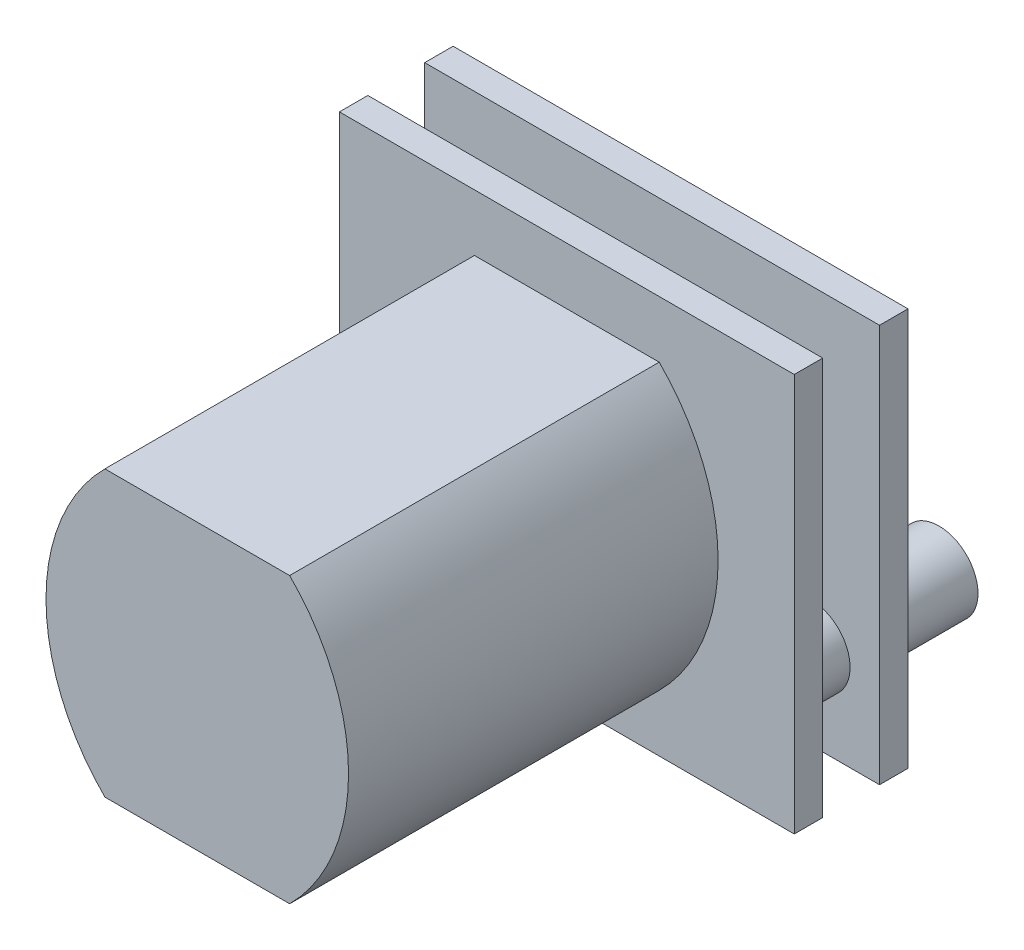
from build123d import *

# Parameters (mm, degrees)
EXTRUDE1_DEPTH  = 13
SKETCH2_W       = 16
SKETCH2_H       = 14
EXTRUDE2_DEPTH  = 1
SKETCH3_R       = 2.248676076
EXTRUDE3_DEPTH  = 1.2
SKETCH4_W       = 0.4
SKETCH4_H       = 0.5
EXTRUDE4_DEPTH  = 1.2
SKETCH5_R       = 1.372998475
EXTRUDE5_DEPTH  = 2
SKETCH6_W       = 16
SKETCH6_H       = 14
EXTRUDE6_DEPTH  = 1
SKETCH7_R       = 1.372998475
EXTRUDE7_DEPTH  = 3.5
SKETCH8_R       = 1.733936405
EXTRUDE8_DEPTH  = 1.2
SKETCH9_W       = 0.301521113
SKETCH9_H       = 0.224907716
EXTRUDE9_DEPTH  = 1.2
SKETCH10_W      = 0.800661527
SKETCH10_H      = 6.121277762
EXTRUDE10_DEPTH = 1.2
SKETCH11_R      = 0.601090718
EXTRUDE11_DEPTH = 1.2
SKETCH12_W      = 0.183794405
SKETCH12_H      = 0.118202218
EXTRUDE12_DEPTH = 1.2
SKETCH13_R      = 2.161420289
EXTRUDE13_DEPTH = 1.2
SKETCH14_W      = 0.467705932
SKETCH14_H      = 0.202573078
EXTRUDE14_DEPTH = 1.2
SKETCH15_R      = 0.577311245
EXTRUDE15_DEPTH = 1.4
SKETCH16_R      = 2.177574352
EXTRUDE16_DEPTH = 0.8
SKETCH17_W      = 0.286885117
SKETCH17_H      = 0.397850676
SKETCH17_W_2    = 0.397850676
SKETCH17_H_2    = 0.286885116
SKETCH17_W_3    = 0.397850677
SKETCH17_W_4    = 0.359139645
SKETCH17_H_3    = 0.201650404
EXTRUDE18_DEPTH = 0.8


with BuildPart() as part:
    # Sketch1 → Extrude1 (new body)
    with BuildSketch(Plane.XY):
        with BuildLine():
            Line((-3.25, 5), (3.25, 5))
            ThreePointArc((3.25, 5), (5.321067812, 0), (3.25, -5))
            Line((3.25, -5), (-3.25, -5))
            ThreePointArc((-3.25, -5), (-5.321067812, 0), (-3.25, 5))
        make_face()
    extrude(amount=EXTRUDE1_DEPTH)

    # Sketch2 → Extrude2 (add)
    with BuildSketch(Plane(origin=(0, 0, 0), x_dir=(-1, 0, 0), z_dir=(0, 0, -1))):
        Rectangle(SKETCH2_W, SKETCH2_H)
    extrude(amount=EXTRUDE2_DEPTH)

    # Sketch3 → Extrude3 (add)
    with BuildSketch(Plane(origin=(0, 0, -1), x_dir=(-1, 0, 0), z_dir=(0, 0, -1))):
        Circle(SKETCH3_R)
    extrude(amount=EXTRUDE3_DEPTH)

    # Sketch4 → Extrude4 (cut)
    with BuildSketch(Plane(origin=(0, 0, -2.2), x_dir=(-1, 0, 0), z_dir=(0, 0, -1))):
        Polygon((-0.459805613, -1.955322187), (-0.622155347, -2.428230808), (-1.000482244, -2.29835102), (-0.838132509, -1.825442399), align=None)
        with Locations((0, -2.248676076)):
            Rectangle(SKETCH4_W, SKETCH4_H)
        Polygon((-1.069784152, -1.700078799), (-1.376890509, -2.094649054), (-1.692546713, -1.848963969), (-1.385440356, -1.454393714), align=None)
        Polygon((-1.56383498, -1.260605494), (-1.982418219, -1.534079573), (-2.201197482, -1.199212982), (-1.782614243, -0.925738903), align=None)
        Polygon((-1.888420022, -0.684526023), (-2.373120155, -0.807268767), (-2.47131435, -0.41950866), (-1.986614217, -0.296765917), align=None)
        Polygon((-2.008365453, -0.034267536), (-2.506657699, 0.007022136), (-2.473625961, 0.405655933), (-1.975333715, 0.364366261), align=None)
        Polygon((-1.910673324, 0.61970437), (-2.368559987, 0.820552082), (-2.207881817, 1.186861413), (-1.749995154, 0.9860137), align=None)
        Polygon((-1.605930093, 1.206521692), (-1.973792048, 1.545162477), (-1.70287942, 1.839452042), (-1.335017464, 1.500811256), align=None)
        Polygon((-1.127159418, 1.662593667), (-1.365133115, 2.102330543), (-1.013343614, 2.2927095), (-0.775369918, 1.852972624), align=None)
        Polygon((-0.52624353, 1.938497821), (-0.608540826, 2.431678473), (-0.213996304, 2.497516309), (-0.131699009, 2.004335657), align=None)
        Polygon((0.131699009, 2.004335657), (0.213996304, 2.497516309), (0.608540826, 2.431678473), (0.52624353, 1.938497821), align=None)
        Polygon((0.775369918, 1.852972624), (1.013343614, 2.2927095), (1.365133115, 2.102330543), (1.127159418, 1.662593667), align=None)
        Polygon((1.335017464, 1.500811256), (1.70287942, 1.839452042), (1.973792048, 1.545162477), (1.605930093, 1.206521692), align=None)
        Polygon((1.749995154, 0.9860137), (2.207881817, 1.186861413), (2.368559987, 0.820552082), (1.910673324, 0.61970437), align=None)
        Polygon((1.975333715, 0.364366261), (2.473625961, 0.405655933), (2.506657699, 0.007022136), (2.008365453, -0.034267536), align=None)
        Polygon((1.986614217, -0.296765917), (2.47131435, -0.41950866), (2.373120155, -0.807268767), (1.888420022, -0.684526023), align=None)
        Polygon((1.782614243, -0.925738903), (2.201197482, -1.199212982), (1.982418219, -1.534079573), (1.56383498, -1.260605494), align=None)
        Polygon((1.385440356, -1.454393714), (1.692546713, -1.848963969), (1.376890509, -2.094649054), (1.069784152, -1.700078799), align=None)
        Polygon((0.838132509, -1.825442399), (1.000482244, -2.29835102), (0.622155347, -2.428230808), (0.459805613, -1.955322187), align=None)
    extrude(amount=-EXTRUDE4_DEPTH, mode=Mode.SUBTRACT)

    # Sketch5 → Extrude5 (add)
    with BuildSketch(Plane(origin=(0, 0, -1), x_dir=(-1, 0, 0), z_dir=(0, 0, -1))):
        with Locations((-5.590617774, -3.94150511)):
            Circle(SKETCH5_R)
    extrude(amount=EXTRUDE5_DEPTH)

    # Sketch6 → Extrude6 (add)
    with BuildSketch(Plane(origin=(0, 0, -3), x_dir=(-1, 0, 0), z_dir=(0, 0, -1))):
        Rectangle(SKETCH6_W, SKETCH6_H)
    extrude(amount=EXTRUDE6_DEPTH)

    # Sketch7 → Extrude7 (add)
    with BuildSketch(Plane(origin=(0, 0, -4), x_dir=(-1, 0, 0), z_dir=(0, 0, -1))):
        with Locations((-5.590617774, -3.94150511)):
            Circle(SKETCH7_R)
    extrude(amount=EXTRUDE7_DEPTH)

    # Sketch8 → Extrude8 (add)
    with BuildSketch(Plane(origin=(0, 0, -4), x_dir=(-1, 0, 0), z_dir=(0, 0, -1))):
        with Locations(Location((0, 0, 0), (0, 0, 180))):
            Circle(SKETCH8_R)
    extrude(amount=EXTRUDE8_DEPTH)

    # Sketch9 → Extrude9 (cut)
    with BuildSketch(Plane(origin=(0, 0, -5.2), x_dir=(-1, 0, 0), z_dir=(0, 0, -1))):
        with Locations((1.733936406, 0)):
            Rectangle(SKETCH9_W, SKETCH9_H)
        Polygon((1.840035405, -0.423081807), (1.776671579, -0.638879181), (1.48736419, -0.553930867), (1.550728016, -0.338133493), align=None)
        Polygon((1.646305123, -0.9243419), (1.524710831, -1.113546312), (1.27105513, -0.950531691), (1.392649422, -0.761327279), align=None)
        Polygon((1.319200991, -1.35071731), (1.14922708, -1.498000543), (0.951772743, -1.27012609), (1.121746654, -1.122842858), align=None)
        Polygon((0.885223041, -1.667665637), (0.680639785, -1.761095679), (0.555383388, -1.486822428), (0.759966644, -1.393392385), align=None)
        Polygon((0.379529584, -1.849509612), (0.156911103, -1.881517317), (0.114000175, -1.583065254), (0.336618655, -1.551057549), align=None)
        Polygon((-0.156911103, -1.881517317), (-0.379529584, -1.849509612), (-0.336618655, -1.551057549), (-0.114000175, -1.583065254), align=None)
        Polygon((-0.680639785, -1.761095679), (-0.885223041, -1.667665637), (-0.759966644, -1.393392385), (-0.555383388, -1.486822428), align=None)
        Polygon((-1.14922708, -1.498000543), (-1.319200991, -1.35071731), (-1.121746654, -1.122842858), (-0.951772743, -1.27012609), align=None)
        Polygon((-1.524710831, -1.113546312), (-1.646305123, -0.9243419), (-1.392649422, -0.761327279), (-1.27105513, -0.950531691), align=None)
        Polygon((-1.776671579, -0.638879181), (-1.840035405, -0.423081807), (-1.550728016, -0.338133493), (-1.48736419, -0.553930867), align=None)
        with Locations((-1.733936406, 0)):
            Rectangle(SKETCH9_W, SKETCH9_H)
        Polygon((-1.840035405, 0.423081807), (-1.776671579, 0.638879181), (-1.48736419, 0.553930867), (-1.550728016, 0.338133493), align=None)
        Polygon((-1.646305123, 0.9243419), (-1.524710831, 1.113546312), (-1.27105513, 0.950531691), (-1.392649422, 0.761327279), align=None)
        Polygon((-1.319200991, 1.35071731), (-1.14922708, 1.498000543), (-0.951772743, 1.27012609), (-1.121746654, 1.122842858), align=None)
        Polygon((-0.885223041, 1.667665637), (-0.680639785, 1.761095679), (-0.555383388, 1.486822428), (-0.759966644, 1.393392385), align=None)
        Polygon((-0.379529584, 1.849509612), (-0.156911103, 1.881517317), (-0.114000175, 1.583065254), (-0.336618655, 1.551057549), align=None)
        Polygon((0.156911103, 1.881517317), (0.379529584, 1.849509612), (0.336618655, 1.551057549), (0.114000175, 1.583065254), align=None)
        Polygon((0.680639785, 1.761095679), (0.885223041, 1.667665637), (0.759966644, 1.393392385), (0.555383388, 1.486822428), align=None)
        Polygon((1.14922708, 1.498000543), (1.319200991, 1.35071731), (1.121746654, 1.122842858), (0.951772743, 1.27012609), align=None)
        Polygon((1.524710831, 1.113546312), (1.646305123, 0.9243419), (1.392649422, 0.761327279), (1.27105513, 0.950531691), align=None)
        Polygon((1.776671579, 0.638879181), (1.840035405, 0.423081807), (1.550728016, 0.338133493), (1.48736419, 0.553930867), align=None)
    extrude(amount=-EXTRUDE9_DEPTH, mode=Mode.SUBTRACT)

    # Sketch10 → Extrude10 (cut)
    with BuildSketch(Plane.XZ.offset(5)):
        with Locations((1.473917579, 5.887601999)):
            Rectangle(SKETCH10_W, SKETCH10_H)
        with Locations((-1.526082421, 5.887601999)):
            Rectangle(SKETCH10_W, SKETCH10_H)
    extrude(amount=-EXTRUDE10_DEPTH, mode=Mode.SUBTRACT)

    # Sketch11 → Extrude11 (add)
    with BuildSketch(Plane(origin=(0, 0, -5.2), x_dir=(-1, 0, 0), z_dir=(0, 0, -1))):
        Circle(SKETCH11_R)
    extrude(amount=EXTRUDE11_DEPTH)

    # Sketch12 → Extrude12 (cut)
    with BuildSketch(Plane(origin=(0, 0, -6.4), x_dir=(-1, 0, 0), z_dir=(0, 0, -1))):
        with Locations((-0.601090719, 0)):
            Rectangle(SKETCH12_W, SKETCH12_H)
        Polygon((-0.498699159, 0.118617563), (-0.458271619, 0.229691315), (-0.630981866, 0.292552704), (-0.671409406, 0.181478952), align=None)
        Polygon((-0.428054323, 0.282029207), (-0.352075403, 0.372577359), (-0.492870086, 0.490718125), (-0.568849007, 0.400169974), align=None)
        Polygon((-0.305779819, 0.411423965), (-0.203413696, 0.470525074), (-0.295310899, 0.629695699), (-0.397677022, 0.57059459), align=None)
        Polygon((-0.146623756, 0.491194922), (-0.030217296, 0.511720522), (-0.06213286, 0.692722678), (-0.17853932, 0.672197078), align=None)
        Polygon((0.030217296, 0.511720522), (0.146623756, 0.491194922), (0.17853932, 0.672197078), (0.06213286, 0.692722678), align=None)
        Polygon((0.203413696, 0.470525074), (0.305779819, 0.411423965), (0.397677022, 0.57059459), (0.295310899, 0.629695699), align=None)
        Polygon((0.352075403, 0.372577359), (0.428054323, 0.282029207), (0.568849007, 0.400169974), (0.492870086, 0.490718125), align=None)
        Polygon((0.458271619, 0.229691315), (0.498699159, 0.118617563), (0.671409406, 0.181478952), (0.630981866, 0.292552704), align=None)
        with Locations((0.601090719, 0)):
            Rectangle(SKETCH12_W, SKETCH12_H)
        Polygon((0.498699159, -0.118617563), (0.458271619, -0.229691315), (0.630981866, -0.292552704), (0.671409406, -0.181478952), align=None)
        Polygon((0.428054323, -0.282029207), (0.352075403, -0.372577359), (0.492870086, -0.490718125), (0.568849007, -0.400169974), align=None)
        Polygon((0.305779819, -0.411423965), (0.203413696, -0.470525074), (0.295310899, -0.629695699), (0.397677022, -0.57059459), align=None)
        Polygon((0.146623756, -0.491194922), (0.030217296, -0.511720522), (0.06213286, -0.692722678), (0.17853932, -0.672197078), align=None)
        Polygon((-0.030217296, -0.511720522), (-0.146623756, -0.491194922), (-0.17853932, -0.672197078), (-0.06213286, -0.692722678), align=None)
        Polygon((-0.203413696, -0.470525074), (-0.305779819, -0.411423965), (-0.397677022, -0.57059459), (-0.295310899, -0.629695699), align=None)
        Polygon((-0.352075403, -0.372577359), (-0.428054323, -0.282029207), (-0.568849007, -0.400169974), (-0.492870086, -0.490718125), align=None)
        Polygon((-0.458271619, -0.229691315), (-0.498699159, -0.118617563), (-0.671409406, -0.181478952), (-0.630981866, -0.292552704), align=None)
    extrude(amount=-EXTRUDE12_DEPTH, mode=Mode.SUBTRACT)

    # Sketch13 → Extrude13 (add)
    with BuildSketch(Plane(origin=(0, 0, -6.4), x_dir=(-1, 0, 0), z_dir=(0, 0, -1))):
        Circle(SKETCH13_R)
    extrude(amount=EXTRUDE13_DEPTH)

    # Sketch14 → Extrude14 (cut)
    with BuildSketch(Plane(origin=(0, 0, -7.6), x_dir=(-1, 0, 0), z_dir=(0, 0, -1))):
        with Locations((-2.161420289, 0)):
            Rectangle(SKETCH14_W, SKETCH14_H)
        Polygon((-2.349910423, 0.474883074), (-2.301431513, 0.671569746), (-1.847316265, 0.55964039), (-1.895795176, 0.362953719), align=None)
        Polygon((-2.167979339, 1.023454209), (-2.073838936, 1.202823761), (-1.6597059, 0.985469977), (-1.753846303, 0.806100425), align=None)
        Polygon((-1.860053175, 1.512545906), (-1.725722378, 1.664174031), (-1.375639461, 1.35402763), (-1.509970258, 1.202399505), align=None)
        Polygon((-1.444027482, 1.913733932), (-1.277313108, 2.028808556), (-1.011625856, 1.64389412), (-1.178340231, 1.528819496), align=None)
        Polygon((-0.944080161, 2.203702698), (-0.754671043, 2.275536101), (-0.588820234, 1.838223458), (-0.778229352, 1.766390055), align=None)
        Polygon((-0.389266332, 2.365600273), (-0.188170241, 2.39001776), (-0.13179452, 1.925721931), (-0.332890612, 1.901304444), align=None)
        Polygon((0.188170241, 2.39001776), (0.389266332, 2.365600273), (0.332890612, 1.901304444), (0.13179452, 1.925721931), align=None)
        Polygon((0.754671043, 2.275536101), (0.944080161, 2.203702698), (0.778229352, 1.766390055), (0.588820234, 1.838223458), align=None)
        Polygon((1.277313108, 2.028808556), (1.444027482, 1.913733932), (1.178340231, 1.528819496), (1.011625856, 1.64389412), align=None)
        Polygon((1.725722378, 1.664174031), (1.860053175, 1.512545906), (1.509970258, 1.202399505), (1.375639461, 1.35402763), align=None)
        Polygon((2.073838936, 1.202823761), (2.167979339, 1.023454209), (1.753846303, 0.806100425), (1.6597059, 0.985469977), align=None)
        Polygon((2.301431513, 0.671569746), (2.349910423, 0.474883074), (1.895795176, 0.362953719), (1.847316265, 0.55964039), align=None)
        with Locations((2.161420289, 0)):
            Rectangle(SKETCH14_W, SKETCH14_H)
        Polygon((2.349910423, -0.474883074), (2.301431513, -0.671569746), (1.847316265, -0.55964039), (1.895795176, -0.362953719), align=None)
        Polygon((2.167979339, -1.023454209), (2.073838936, -1.202823761), (1.6597059, -0.985469977), (1.753846303, -0.806100425), align=None)
        Polygon((1.860053175, -1.512545906), (1.725722378, -1.664174031), (1.375639461, -1.35402763), (1.509970258, -1.202399505), align=None)
        Polygon((1.444027482, -1.913733932), (1.277313108, -2.028808556), (1.011625856, -1.64389412), (1.178340231, -1.528819496), align=None)
        Polygon((0.944080161, -2.203702698), (0.754671043, -2.275536101), (0.588820234, -1.838223458), (0.778229352, -1.766390055), align=None)
        Polygon((0.389266332, -2.365600273), (0.188170241, -2.39001776), (0.13179452, -1.925721931), (0.332890612, -1.901304444), align=None)
        Polygon((-0.188170241, -2.39001776), (-0.389266332, -2.365600273), (-0.332890612, -1.901304444), (-0.13179452, -1.925721931), align=None)
        Polygon((-0.754671043, -2.275536101), (-0.944080161, -2.203702698), (-0.778229352, -1.766390055), (-0.588820234, -1.838223458), align=None)
        Polygon((-1.277313108, -2.028808556), (-1.444027482, -1.913733932), (-1.178340231, -1.528819496), (-1.011625856, -1.64389412), align=None)
        Polygon((-1.725722378, -1.664174031), (-1.860053175, -1.512545906), (-1.509970258, -1.202399505), (-1.375639461, -1.35402763), align=None)
        Polygon((-2.073838936, -1.202823761), (-2.167979339, -1.023454209), (-1.753846303, -0.806100425), (-1.6597059, -0.985469977), align=None)
        Polygon((-2.301431513, -0.671569746), (-2.349910423, -0.474883074), (-1.895795176, -0.362953719), (-1.847316265, -0.55964039), align=None)
    extrude(amount=-EXTRUDE14_DEPTH, mode=Mode.SUBTRACT)

    # Sketch15 → Extrude15 (add)
    with BuildSketch(Plane(origin=(0, 0, -4), x_dir=(-1, 0, 0), z_dir=(0, 0, -1))):
        with Locations(Location((-2.942375977, 0, 0), (0, 0, 180))):
            Circle(SKETCH15_R)
    extrude(amount=EXTRUDE15_DEPTH)

    # Sketch16 → Extrude16 (add)
    with BuildSketch(Plane(origin=(0, 0, -5.4), x_dir=(-1, 0, 0), z_dir=(0, 0, -1))):
        with Locations((-2.942375977, 0)):
            Circle(SKETCH16_R)
    extrude(amount=EXTRUDE16_DEPTH)

    # Sketch17 → Extrude18 (cut)
    # profile 1 of 20: a face of its own
    with BuildSketch(Plane(origin=(0, 0, -6.2), x_dir=(-1, 0, 0), z_dir=(0, 0, -1))):
        with Locations((-2.942375977, 2.177574352)):
            Rectangle(SKETCH17_W, SKETCH17_H)
    # profile 2 of 20: a face of its own
    with BuildSketch(Plane(origin=(0, 0, -6.2), x_dir=(-1, 0, 0), z_dir=(0, 0, -1))):
        Polygon((-2.467361785, 1.926133226), (-2.344419165, 2.304511704), (-2.071575206, 2.215859328), (-2.194517826, 1.83748085), align=None)
    # profile 3 of 20: a face of its own
    with BuildSketch(Plane(origin=(0, 0, -6.2), x_dir=(-1, 0, 0), z_dir=(0, 0, -1))):
        Polygon((-1.895402735, 1.685074098), (-1.661551974, 2.006942057), (-1.429457039, 1.838315216), (-1.6633078, 1.516447258), align=None)
    # profile 4 of 20: a face of its own
    with BuildSketch(Plane(origin=(0, 0, -6.2), x_dir=(-1, 0, 0), z_dir=(0, 0, -1))):
        Polygon((-1.425928719, 1.279068177), (-1.104060761, 1.512918937), (-0.93543392, 1.280824003), (-1.257301879, 1.046973242), align=None)
    # profile 5 of 20: a face of its own
    with BuildSketch(Plane(origin=(0, 0, -6.2), x_dir=(-1, 0, 0), z_dir=(0, 0, -1))):
        Polygon((-1.104895127, 0.747858151), (-0.726516649, 0.870800771), (-0.637864272, 0.597956812), (-1.016242751, 0.475014191), align=None)
    # profile 6 of 20: a face of its own
    with BuildSketch(Plane(origin=(0, 0, -6.2), x_dir=(-1, 0, 0), z_dir=(0, 0, -1))):
        with Locations((-0.764801625, 0)):
            Rectangle(SKETCH17_W_2, SKETCH17_H_2)
    # profile 7 of 20: a face of its own
    with BuildSketch(Plane(origin=(0, 0, -6.2), x_dir=(-1, 0, 0), z_dir=(0, 0, -1))):
        Polygon((-1.016242751, -0.475014191), (-0.637864272, -0.597956812), (-0.726516649, -0.870800771), (-1.104895127, -0.747858151), align=None)
    # profile 8 of 20: a face of its own
    with BuildSketch(Plane(origin=(0, 0, -6.2), x_dir=(-1, 0, 0), z_dir=(0, 0, -1))):
        Polygon((-1.257301879, -1.046973242), (-0.93543392, -1.280824003), (-1.104060761, -1.512918937), (-1.425928719, -1.279068177), align=None)
    # profile 9 of 20: a face of its own
    with BuildSketch(Plane(origin=(0, 0, -6.2), x_dir=(-1, 0, 0), z_dir=(0, 0, -1))):
        Polygon((-1.6633078, -1.516447258), (-1.429457039, -1.838315216), (-1.661551974, -2.006942057), (-1.895402735, -1.685074098), align=None)
    # profile 10 of 20: a face of its own
    with BuildSketch(Plane(origin=(0, 0, -6.2), x_dir=(-1, 0, 0), z_dir=(0, 0, -1))):
        Polygon((-2.194517826, -1.83748085), (-2.071575206, -2.215859328), (-2.344419165, -2.304511704), (-2.467361785, -1.926133226), align=None)
    # profile 11 of 20: a face of its own
    with BuildSketch(Plane(origin=(0, 0, -6.2), x_dir=(-1, 0, 0), z_dir=(0, 0, -1))):
        with Locations((-2.942375977, -2.177574352)):
            Rectangle(SKETCH17_W, SKETCH17_H)
    # profile 12 of 20: a face of its own
    with BuildSketch(Plane(origin=(0, 0, -6.2), x_dir=(-1, 0, 0), z_dir=(0, 0, -1))):
        Polygon((-3.417390168, -1.926133226), (-3.540332788, -2.304511704), (-3.813176748, -2.215859328), (-3.690234128, -1.83748085), align=None)
    # profile 13 of 20: a face of its own
    with BuildSketch(Plane(origin=(0, 0, -6.2), x_dir=(-1, 0, 0), z_dir=(0, 0, -1))):
        Polygon((-3.989349219, -1.685074098), (-4.223199979, -2.006942057), (-4.455294914, -1.838315216), (-4.221444154, -1.516447258), align=None)
    # profile 14 of 20: a face of its own
    with BuildSketch(Plane(origin=(0, 0, -6.2), x_dir=(-1, 0, 0), z_dir=(0, 0, -1))):
        Polygon((-4.458823234, -1.279068177), (-4.780691193, -1.512918937), (-4.949318034, -1.280824003), (-4.627450075, -1.046973242), align=None)
    # profile 15 of 20: a face of its own
    with BuildSketch(Plane(origin=(0, 0, -6.2), x_dir=(-1, 0, 0), z_dir=(0, 0, -1))):
        Polygon((-4.779856826, -0.747858151), (-5.158235305, -0.870800771), (-5.246887681, -0.597956812), (-4.868509203, -0.475014191), align=None)
    # profile 16 of 20: a face of its own
    with BuildSketch(Plane(origin=(0, 0, -6.2), x_dir=(-1, 0, 0), z_dir=(0, 0, -1))):
        with Locations((-5.119950328, 0)):
            Rectangle(SKETCH17_W_3, SKETCH17_H_2)
        with Locations((-5.119950328, 0)):
            Rectangle(SKETCH17_W_4, SKETCH17_H_3, mode=Mode.SUBTRACT)
    # profile 17 of 20: a face of its own
    with BuildSketch(Plane(origin=(0, 0, -6.2), x_dir=(-1, 0, 0), z_dir=(0, 0, -1))):
        Polygon((-4.868509203, 0.475014191), (-5.246887681, 0.597956812), (-5.158235305, 0.870800771), (-4.779856826, 0.747858151), align=None)
    # profile 18 of 20: a face of its own
    with BuildSketch(Plane(origin=(0, 0, -6.2), x_dir=(-1, 0, 0), z_dir=(0, 0, -1))):
        Polygon((-4.627450075, 1.046973242), (-4.949318034, 1.280824003), (-4.780691193, 1.512918937), (-4.458823234, 1.279068177), align=None)
    # profile 19 of 20: a face of its own
    with BuildSketch(Plane(origin=(0, 0, -6.2), x_dir=(-1, 0, 0), z_dir=(0, 0, -1))):
        Polygon((-4.221444154, 1.516447258), (-4.455294914, 1.838315216), (-4.223199979, 2.006942057), (-3.989349219, 1.685074098), align=None)
    # profile 20 of 20: a face of its own
    with BuildSketch(Plane(origin=(0, 0, -6.2), x_dir=(-1, 0, 0), z_dir=(0, 0, -1))):
        Polygon((-3.690234128, 1.83748085), (-3.813176748, 2.215859328), (-3.540332788, 2.304511704), (-3.417390168, 1.926133226), align=None)
    extrude(amount=-EXTRUDE18_DEPTH, mode=Mode.SUBTRACT)


with BuildPart() as extrude18_piece_1:
    # of the separate pieces the step leaves, piece 1, a body of its own (extrude18_pieces)
    add(part.part.solids().sort_by_distance((0.769531231, 0.143442558, -5.4))[0])


with BuildPart() as extrude18_piece_2:
    # of the separate pieces the step leaves, piece 2, a body of its own (extrude18_pieces)
    add(part.part.solids().sort_by_distance((4.940380506, 0.100825202, -5.4))[0])


solid = Compound([extrude18_piece_1.part, extrude18_piece_2.part])
